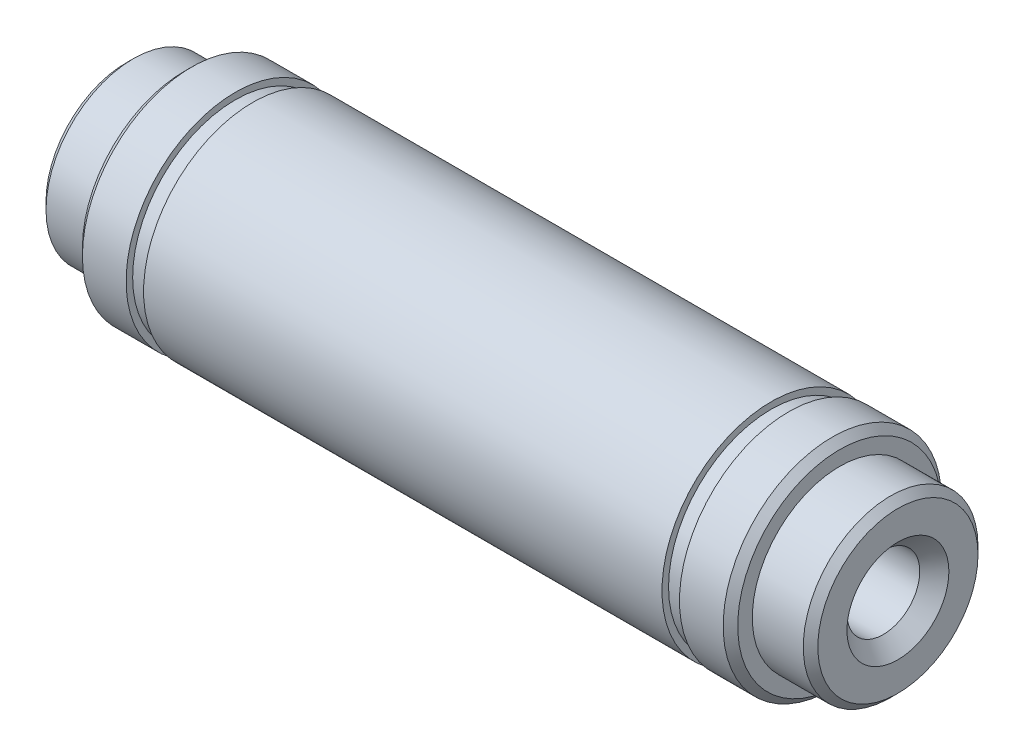
from build123d import *

# Parameters (mm, degrees)
HOLE_WIZARD_M61_D           = 5
HOLE_WIZARD_M61_DEPTH       = 17
HOLE_WIZARD_M61_CSINK_D     = 7
HOLE_WIZARD_M61_CSINK_ANGLE = 90
HOLE_WIZARD_M61_TIP         = 1.502151548
HOLE_WIZARD_M62_D           = 5
HOLE_WIZARD_M62_DEPTH       = 17
HOLE_WIZARD_M62_CSINK_D     = 7
HOLE_WIZARD_M62_CSINK_ANGLE = 90
HOLE_WIZARD_M62_TIP         = 1.502151548
SKETCH_5_W                  = 1.2
SKETCH_5_H                  = 0.45
CHAMFER_2_SIZE              = 0.5


with BuildPart() as part:
    # Эскиз1 → Повернуть1 (revolve)
    with BuildSketch(Plane.XY, mode=Mode.PRIVATE) as revolve_1_sk:
        Polygon((-26.5, 0), (-26.5, 6), (-22.5, 6), (-22.5, 7.5), (22.5, 7.5), (22.5, 6), (26.5, 6), (26.5, 0), align=None)
    revolve(revolve_1_sk.sketch.rotate(Axis((0, 0, 0), (-1, 0, 0)), 90), axis=Axis((0, 0, 0), (-1, 0, 0)))

    # Отверстие обработанное метчиком M61
    with Locations(Plane.ZY.offset(26.5)):
        with Locations((0, 0)):
            CounterSinkHole(HOLE_WIZARD_M61_D / 2, HOLE_WIZARD_M61_CSINK_D / 2, depth=HOLE_WIZARD_M61_DEPTH, counter_sink_angle=HOLE_WIZARD_M61_CSINK_ANGLE)
            with Locations((0, 0, -(HOLE_WIZARD_M61_DEPTH + HOLE_WIZARD_M61_TIP / 2))):  # 118° drill point
                Cone(0, HOLE_WIZARD_M61_D / 2, HOLE_WIZARD_M61_TIP, mode=Mode.SUBTRACT)

    # Отверстие обработанное метчиком M62
    with Locations(Plane(origin=(26.5, 0, 0), x_dir=(0, 0, -1), z_dir=(1, 0, 0))):
        with Locations((0, 0)):
            CounterSinkHole(HOLE_WIZARD_M62_D / 2, HOLE_WIZARD_M62_CSINK_D / 2, depth=HOLE_WIZARD_M62_DEPTH, counter_sink_angle=HOLE_WIZARD_M62_CSINK_ANGLE)
            with Locations((0, 0, -(HOLE_WIZARD_M62_DEPTH + HOLE_WIZARD_M62_TIP / 2))):  # 118° drill point
                Cone(0, HOLE_WIZARD_M62_D / 2, HOLE_WIZARD_M62_TIP, mode=Mode.SUBTRACT)

    # Эскиз5 → Вырез-Повернуть1 (revolve, cut)
    with BuildSketch(Plane.XY, mode=Mode.PRIVATE) as cut_revolve_1_sk:
        with Locations((-18.4, 7.275)):
            Rectangle(SKETCH_5_W, SKETCH_5_H)
        with Locations((18.4, 7.275)):
            Rectangle(SKETCH_5_W, SKETCH_5_H)
    revolve(cut_revolve_1_sk.sketch.rotate(Axis((0, 0, 0), (-1, 0, 0)), 90), axis=Axis((0, 0, 0), (-1, 0, 0)), mode=Mode.SUBTRACT)

    # Фаска2
    chamfer_2_edges = [part.edges().sort_by_distance(p)[0] for p in [
        (26.5, 0, 6),
        (22.5, 0, 7.5),
        (-22.5, 0, 7.5),
        (-26.5, 0, 6),
    ]]
    chamfer(chamfer_2_edges, length=CHAMFER_2_SIZE)


solid = part.part
